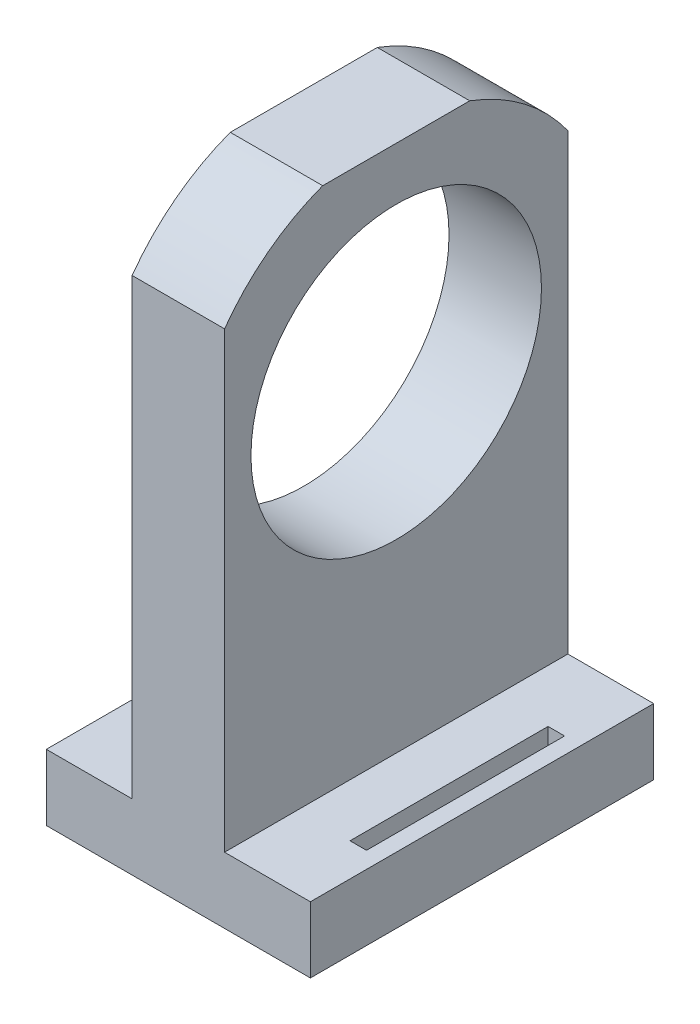
from build123d import *

# Parameters (mm, degrees)
SKETCH1_W           = 20
SKETCH1_H           = 26
SKETCH1_W_2         = 1.25
SKETCH1_H_2         = 15
BOSS_EXTRUDE5_DEPTH = 5
SKETCH3_W           = 7
SKETCH3_H           = 26
BOSS_EXTRUDE6_DEPTH = 40
CUT_EXTRUDE1_REACH  = 55.696
SKETCH5_R           = 11


with BuildPart() as part:
    # Sketch1 → Boss-Extrude5 (new body)
    with BuildSketch(Plane(origin=(0, 0, 0), x_dir=(1, 0, 0), z_dir=(0, 1, 0))):
        with Locations((10, 13)):
            Rectangle(SKETCH1_W, SKETCH1_H)
        with Locations((1.875, 13)):
            Rectangle(SKETCH1_W_2, SKETCH1_H_2, mode=Mode.SUBTRACT)
        with Locations((18.125784532, 13)):
            Rectangle(SKETCH1_W_2, SKETCH1_H_2, mode=Mode.SUBTRACT)
    extrude(amount=BOSS_EXTRUDE5_DEPTH)

    # Sketch3 → Boss-Extrude6 (add)
    with BuildSketch(Plane(origin=(0, 5, 0), x_dir=(1, 0, 0), z_dir=(0, 1, 0))):
        with Locations((10, 13)):
            Rectangle(SKETCH3_W, SKETCH3_H)
    extrude(amount=BOSS_EXTRUDE6_DEPTH)

    # Sketch5 → Cut-Extrude1 (cut, up to next)
    with BuildSketch(Plane(origin=(13.5, 0, 0), x_dir=(0, 0, -1), z_dir=(1, 0, 0)), mode=Mode.PRIVATE) as cut_extrude1_sk1:
        with Locations((13, 30)):
            Circle(SKETCH5_R)
    cut_extrude1_tool1 = extrude(cut_extrude1_sk1.sketch, amount=-CUT_EXTRUDE1_REACH, mode=Mode.PRIVATE) & part.part
    # Sketch5 → Cut-Extrude1 (cut, up to next)
    with BuildSketch(Plane(origin=(13.5, 0, 0), x_dir=(0, 0, -1), z_dir=(1, 0, 0)), mode=Mode.PRIVATE) as cut_extrude1_sk2:
        with BuildLine():
            Line((7.432235637, 45), (0, 45))
            Line((0, 45), (0, 39.327379053))
            ThreePointArc((0, 39.327379053), (3.292522189, 42.718682107), (7.432235637, 45))
        make_face()
    cut_extrude1_tool2 = extrude(cut_extrude1_sk2.sketch, amount=-CUT_EXTRUDE1_REACH, mode=Mode.PRIVATE) & part.part
    # Sketch5 → Cut-Extrude1 (cut, up to next)
    with BuildSketch(Plane(origin=(13.5, 0, 0), x_dir=(0, 0, -1), z_dir=(1, 0, 0)), mode=Mode.PRIVATE) as cut_extrude1_sk3:
        with BuildLine():
            Line((26, 39.327379053), (26, 45))
            Line((26, 45), (18.567764363, 45))
            ThreePointArc((18.567764363, 45), (22.707477811, 42.718682107), (26, 39.327379053))
        make_face()
    cut_extrude1_tool3 = extrude(cut_extrude1_sk3.sketch, amount=-CUT_EXTRUDE1_REACH, mode=Mode.PRIVATE) & part.part
    add(cut_extrude1_tool1.solids().sort_by_distance((13.5, 30, -13))[0], mode=Mode.SUBTRACT)
    add(cut_extrude1_tool2.solids().sort_by_distance((13.5, 43.298273, -2.197768))[0], mode=Mode.SUBTRACT)
    add(cut_extrude1_tool3.solids().sort_by_distance((13.5, 43.298273, -23.802232))[0], mode=Mode.SUBTRACT)


solid = part.part
